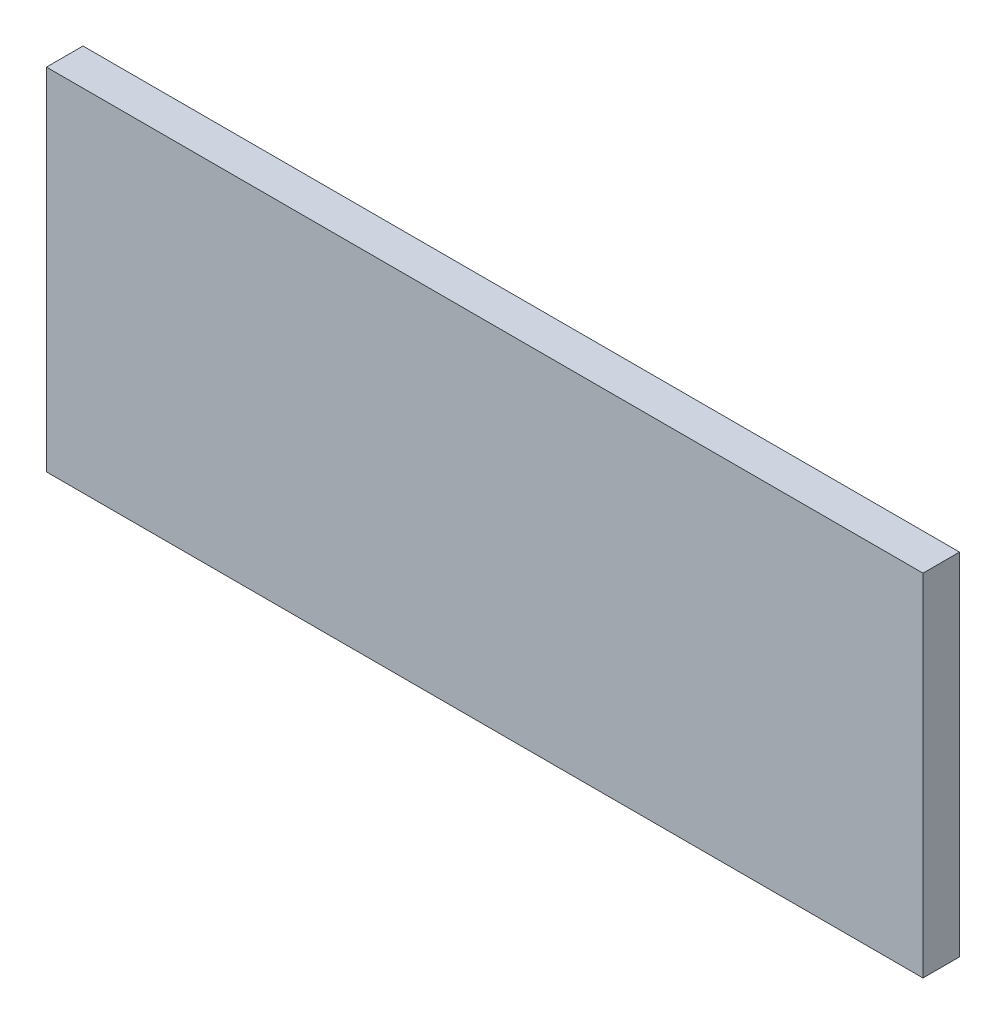
from build123d import *

# Parameters (mm, degrees)
SKETCH1_W           = 76.2
SKETCH1_H           = 30.48
BOSS_EXTRUDE1_DEPTH = 3.175


with BuildPart() as part:
    # Sketch1 → Boss-Extrude1 (new body)
    with BuildSketch(Plane.XY):
        with Locations((-38.1, 15.24)):
            Rectangle(SKETCH1_W, SKETCH1_H)
    extrude(amount=BOSS_EXTRUDE1_DEPTH)


solid = part.part
